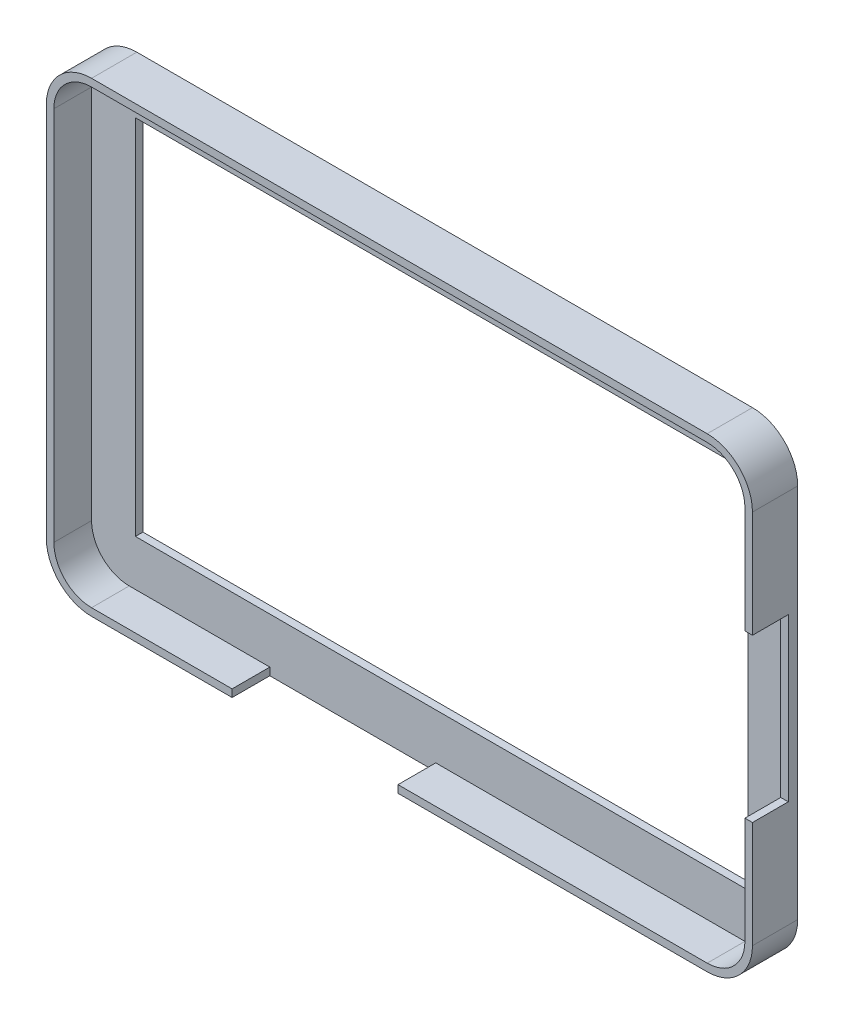
from build123d import *

# Parameters (mm, degrees)
SKIZZE1_W                       = 61.8
SKIZZE1_H                       = 93.64
AUFSATZ_LINEAR_AUSTRAGEN1_DEPTH = 6
VERRUNDUNG1_R                   = 6
WANDUNG1_T                      = -1
SKIZZE2_W                       = 21.5
SKIZZE2_H                       = 9.5
SCHNITT_LINEAR_AUSTRAGEN1_DEPTH = 6
SKIZZE3_W                       = 22
SKIZZE3_H                       = 5
SCHNITT_LINEAR_AUSTRAGEN2_DEPTH = 6
SKIZZE4_W                       = 81.255814336
SKIZZE4_H                       = 48.084928105
SCHNITT_LINEAR_AUSTRAGEN3_DEPTH = 6


with BuildPart() as part:
    # Skizze1 → Aufsatz-Linear austragen1 (new body)
    with BuildSketch(Plane(origin=(0, 0, 0), x_dir=(0, 1, 0), z_dir=(0, 0, 1))):
        Rectangle(SKIZZE1_W, SKIZZE1_H)
    extrude(amount=AUFSATZ_LINEAR_AUSTRAGEN1_DEPTH)

    # Verrundung1
    verrundung1_edges = [part.edges().sort_by_distance(p)[0] for p in [
        (46.82, 30.9, 3),
        (46.82, -30.9, 3),
        (-46.82, -30.9, 3),
        (-46.82, 30.9, 3),
    ]]
    fillet(verrundung1_edges, radius=VERRUNDUNG1_R)

    # Wandung1
    wandung1_openings = [part.faces().sort_by_distance(p)[0] for p in [
        (0, 0, 6),
    ]]
    offset(amount=WANDUNG1_T, openings=wandung1_openings, kind=Kind.INTERSECTION)

    # Skizze2 → Schnitt-Linear austragen1 (cut)
    with BuildSketch(Plane.YZ.offset(46.82)):
        with Locations((0, 6)):
            Rectangle(SKIZZE2_W, SKIZZE2_H)
    extrude(amount=-SCHNITT_LINEAR_AUSTRAGEN1_DEPTH, mode=Mode.SUBTRACT)

    # Skizze3 → Schnitt-Linear austragen2 (cut)
    with BuildSketch(Plane.XZ.offset(30.9)):
        with Locations((-11.18, 3.5)):
            Rectangle(SKIZZE3_W, SKIZZE3_H)
    extrude(amount=-SCHNITT_LINEAR_AUSTRAGEN2_DEPTH, mode=Mode.SUBTRACT)

    # Skizze4 → Schnitt-Linear austragen3 (cut)
    with BuildSketch(Plane(origin=(0, 0, 0), x_dir=(1, 0, 0), z_dir=(0, 0, -1))):
        with Locations((0.624387115, -0.234506354)):
            Rectangle(SKIZZE4_W, SKIZZE4_H)
    extrude(amount=-SCHNITT_LINEAR_AUSTRAGEN3_DEPTH, mode=Mode.SUBTRACT)


solid = part.part
